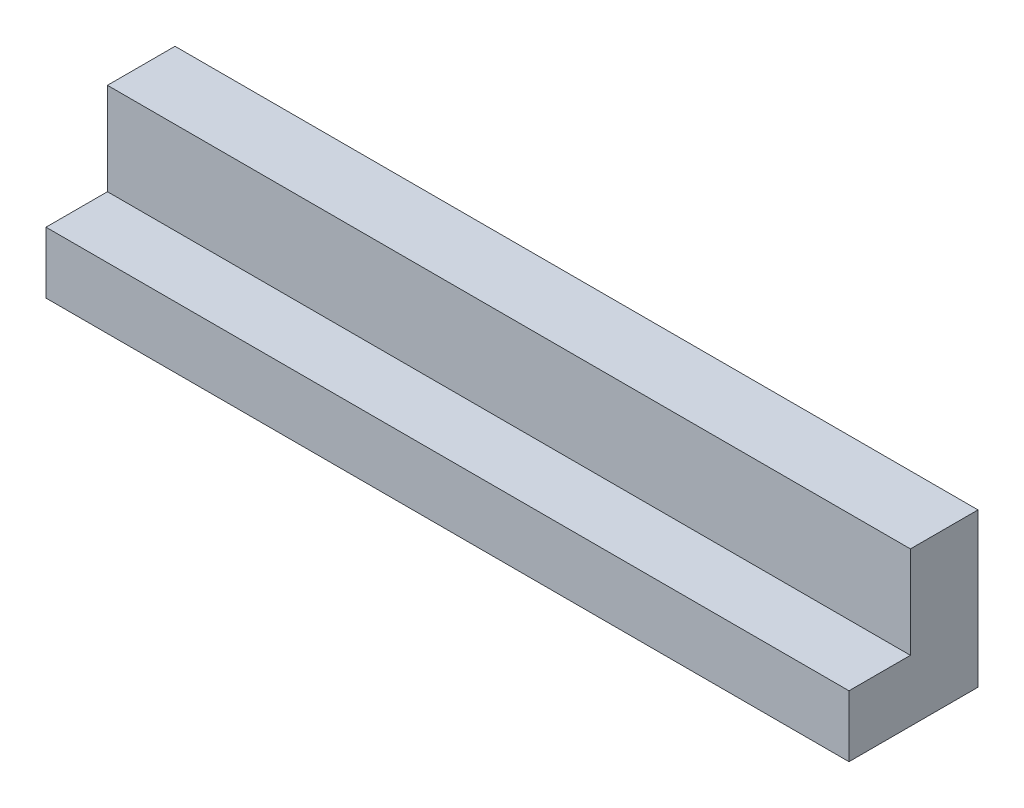
from build123d import *

# Parameters (mm, degrees)
ESQUISSE2_W                  = 261.4
ESQUISSE2_H                  = 50
BOSS_EXTRU_1_DEPTH           = 42
ENL_V_MAT_EXTRU_1_DEPTH      = 270.432663202
ENL_V_MAT_EXTRU_1_DEPTH_BACK = 20


with BuildPart() as part:
    # Esquisse2 → Boss.-Extru.1 (new body)
    with BuildSketch(Plane.XY):
        with Locations((130.7, 25)):
            Rectangle(ESQUISSE2_W, ESQUISSE2_H)
    extrude(amount=BOSS_EXTRU_1_DEPTH)

    # Esquisse3 → Enlèv. mat.-Extru.1 (cut, two sides: drawn at the far end of the back side and taken through both)
    with BuildSketch(Plane.XY.offset(42).offset(-ENL_V_MAT_EXTRU_1_DEPTH_BACK)):
        Polygon((-536.231736025, 20), (0, 20), (261.4, 20), (797.631736025, 20), (797.631736025, 1092.46347205), (-536.231736025, 1092.46347205), align=None)
    extrude(amount=ENL_V_MAT_EXTRU_1_DEPTH + ENL_V_MAT_EXTRU_1_DEPTH_BACK, mode=Mode.SUBTRACT)


solid = part.part
